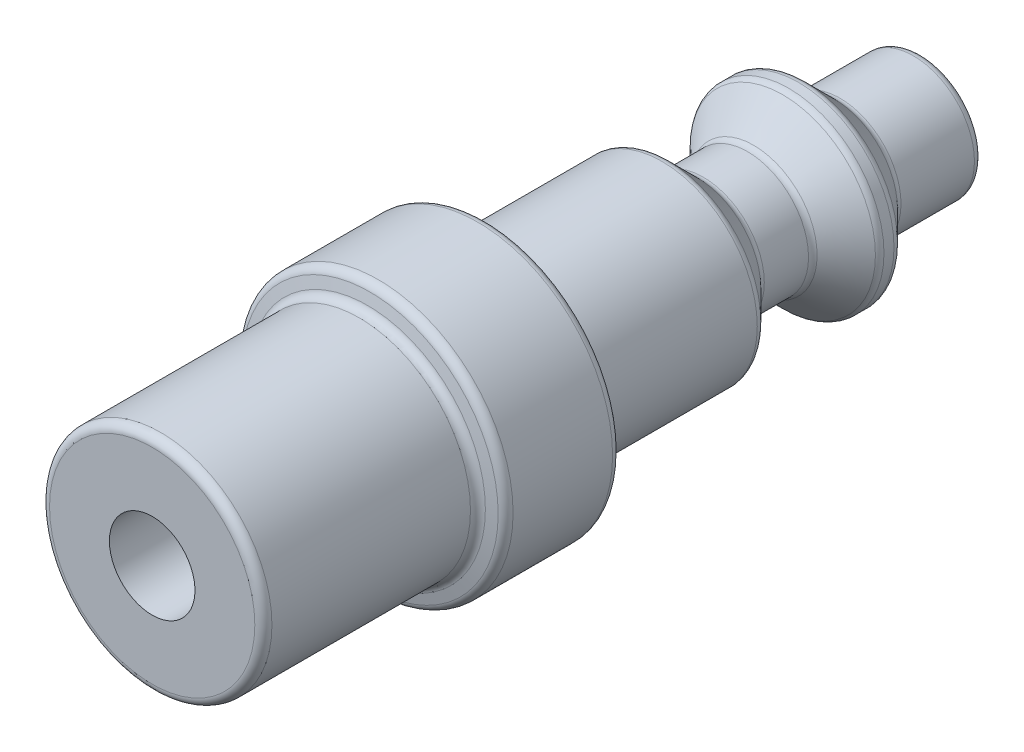
from build123d import *

# Parameters (mm, degrees)
SKETCH1_R           = 7.875
BOSS_EXTRUDE1_DEPTH = 45
SKETCH3_R           = 2.5
CUT_EXTRUDE1_DEPTH  = 47.357645001
FILLET1_R           = 0.5


with BuildPart() as part:
    # Sketch1 → Boss-Extrude1 (new body)
    with BuildSketch(Plane.XY):
        with Locations(Location((0, 0, 0), (0, 0, 180))):
            Circle(SKETCH1_R)
    extrude(amount=BOSS_EXTRUDE1_DEPTH)

    # Sketch2 → Cut-Revolve1 (revolve, cut)
    with BuildSketch(Plane(origin=(0, 0, 0), x_dir=(1, 0, 0), z_dir=(0, 1, 0))):
        Polygon((5.563744461, -14.987420791), (3.563744461, -12.99161386), (3.563744461, -9.99161386), (5.563744461, -7.99580693), (5.563744461, -6.99580693), (3.563744461, -5), (3.563744461, 0), (17.246301574, 0), (17.246301574, -45), (6.5, -45), (6.5, -32.5), (7.875, -32.174923206), (7.875, -25.574923206), (5.563744461, -24.987420791), align=None)
    revolve(axis=Axis((0, 0, 45), (0, 0, -1)), mode=Mode.SUBTRACT)

    # Sketch3 → Cut-Extrude1 (cut, through all)
    with BuildSketch(Plane(origin=(0, 0, 0), x_dir=(-1, 0, 0), z_dir=(0, 0, -1))):
        Circle(SKETCH3_R)
    extrude(amount=-CUT_EXTRUDE1_DEPTH, mode=Mode.SUBTRACT)

    # Fillet1
    fillet1_edges = [part.edges().sort_by_distance(p)[0] for p in [
        (-3.563744461, 0, 5),
        (-5.563744461, 0, 6.99580693),
        (-5.563744461, 0, 7.99580693),
        (-3.563744461, 0, 0),
        (-3.563744461, 0, 9.99161386),
        (-3.563744461, 0, 12.99161386),
        (-5.563744461, 0, 14.987420791),
        (-5.563744461, 0, 24.987420791),
        (0, 7.875, 25.574923206),
        (0, 7.875, 32.174923206),
        (-6.5, 0, 32.5),
        (-6.5, 0, 45),
    ]]
    fillet(fillet1_edges, radius=FILLET1_R)


solid = part.part
